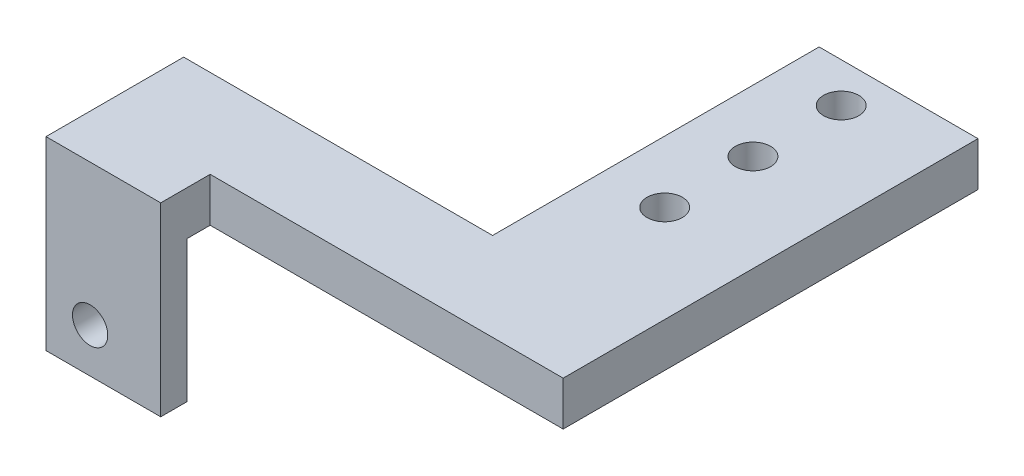
from build123d import *

# Parameters (mm, degrees)
SALIENTE_EXTRUIR1_DEPTH = 5
CROQUIS2_W              = 13
CROQUIS2_H              = 3
SALIENTE_EXTRUIR2_DEPTH = 16
CROQUIS3_R              = 2
CORTAR_EXTRUIR1_DEPTH   = 16
CROQUIS7_R              = 2
CORTAR_EXTRUIR2_DEPTH   = 16


with BuildPart() as part:
    # Croquis1 → Saliente-Extruir1 (new body)
    with BuildSketch(Plane(origin=(0, 0, 0), x_dir=(1, 0, 0), z_dir=(0, 1, 0))):
        Polygon((27.5, -11.160546845), (-12.5, -11.160546845), (-12.5, -16.760546845), (-25.5, -16.760546845), (-25.5, -1.160546845), (9.5, -1.160546845), (9.5, 35.839453155), (27.5, 35.839453155), align=None)
    extrude(amount=SALIENTE_EXTRUIR1_DEPTH)

    # Croquis2 → Saliente-Extruir2 (add)
    with BuildSketch(Plane(origin=(0, 0, 0), x_dir=(-1, 0, 0), z_dir=(0, -1, 0))):
        with Locations((19, -15.260546845)):
            Rectangle(CROQUIS2_W, CROQUIS2_H)
    extrude(amount=SALIENTE_EXTRUIR2_DEPTH)

    # Croquis3 → Cortar-Extruir1 (cut)
    with BuildSketch(Plane(origin=(0, 5, 0), x_dir=(1, 0, 0), z_dir=(0, 1, 0))):
        with Locations(Location((16.5, 31.339453155, 0), (0, 0, 270))):
            Circle(CROQUIS3_R)
        with Locations(Location((16.5, 21.339453155, 0), (0, 0, 270))):
            Circle(CROQUIS3_R)
        with Locations(Location((16.5, 11.339453155, 0), (0, 0, 270))):
            Circle(CROQUIS3_R)
    extrude(amount=-CORTAR_EXTRUIR1_DEPTH, mode=Mode.SUBTRACT)

    # Croquis7 → Cortar-Extruir2 (cut)
    with BuildSketch(Plane(origin=(0, 0, 13.760546845), x_dir=(-1, 0, 0), z_dir=(0, 0, -1))):
        with Locations((20.5, -11)):
            Circle(CROQUIS7_R)
    extrude(amount=-CORTAR_EXTRUIR2_DEPTH, mode=Mode.SUBTRACT)


solid = part.part
